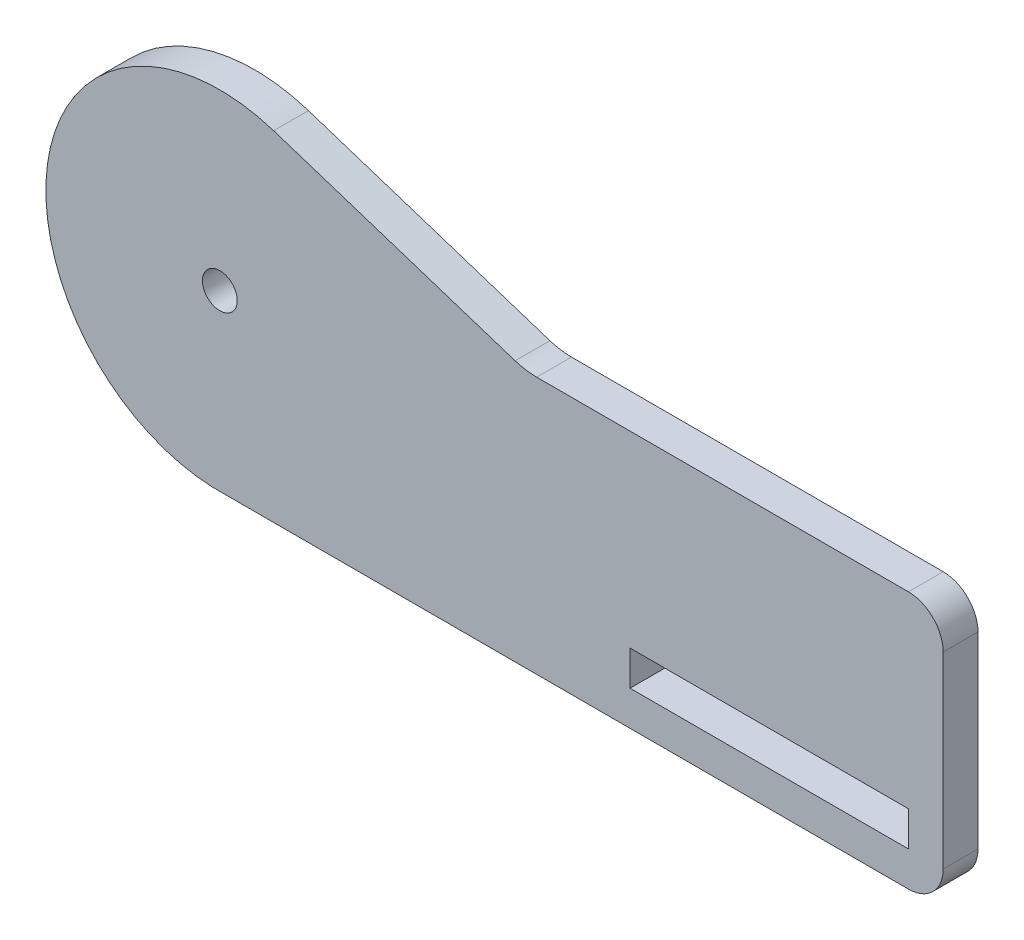
from build123d import *

# Parameters (mm, degrees)
EXTRUIR1_DEPTH = 2.5
REDONDEO1_R    = 10
CROQUIS2_R     = 2.5
EXTRUIR2_DEPTH = 10
REDONDEO2_R    = 5
CROQUIS4_W     = 40
CROQUIS4_H     = 5
EXTRUIR3_DEPTH = 10


with BuildPart() as part:
    # Croquis1 → Extruir1 (new, symmetric)
    with BuildSketch(Plane.XY):
        with BuildLine():
            Line((78.941483087, 11.999998301), (18.941483087, 11.999994988))
            Line((18.941483087, 11.999994988), (-17.269168309, 23.774653719))
            ThreePointArc((-17.269168309, 23.774653719), (-49.603355409, 4.435638782), (-26.058513909, -24.977582614))
            Line((-26.058513909, -24.977582614), (78.941483697, -25.000001699))
            Line((78.941483697, -25.000001699), (78.941483697, -1.699e-06))
            Line((78.941483697, -1.699e-06), (78.941483087, 11.999998301))
        make_face()
    extrude(amount=EXTRUIR1_DEPTH, both=True)

    # Redondeo1
    redondeo1_edges = [part.edges().sort_by_distance(p)[0] for p in [
        (18.941483087, 11.999994988, 0),
    ]]
    fillet(redondeo1_edges, radius=REDONDEO1_R)

    # Croquis2 → Extruir2 (cut)
    with BuildSketch(Plane.XY.offset(2.5)):
        with Locations((-25.000000078, -1.697e-06)):
            Circle(CROQUIS2_R)
    extrude(amount=-EXTRUIR2_DEPTH, mode=Mode.SUBTRACT)

    # Redondeo2
    redondeo2_edges = [part.edges().sort_by_distance(p)[0] for p in [
        (78.941483697, -25.000001699, 0),
        (78.941483087, 11.999998301, 0),
    ]]
    fillet(redondeo2_edges, radius=REDONDEO2_R)

    # Croquis4 → Extruir3 (cut)
    with BuildSketch(Plane.XY.offset(2.5)):
        with Locations((53.941483697, -17.498934009)):
            Rectangle(CROQUIS4_W, CROQUIS4_H)
    extrude(amount=-EXTRUIR3_DEPTH, mode=Mode.SUBTRACT)


solid = part.part
